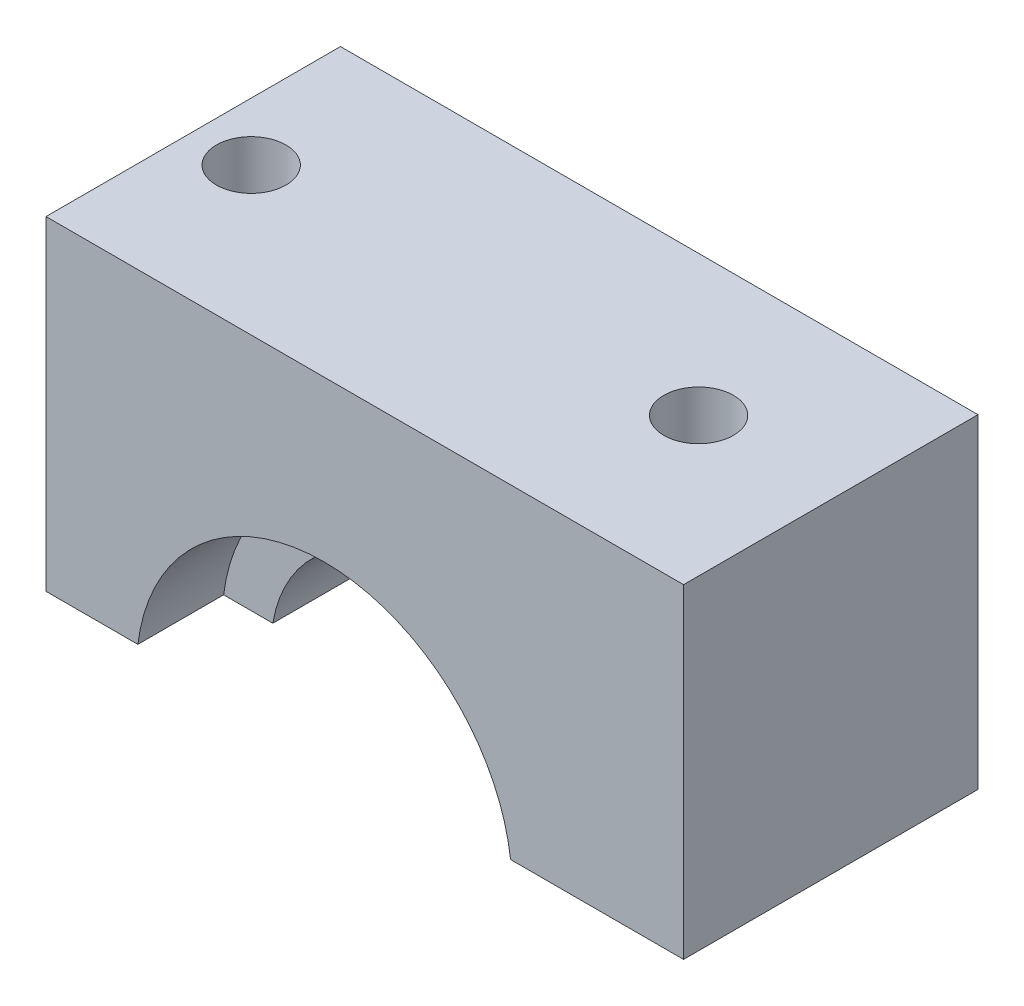
from build123d import *

# Parameters (mm, degrees)
SKETCH1_W           = 24
SKETCH1_H           = 12.7
BOSS_EXTRUDE1_DEPTH = 15
SKETCH2_R           = 6
CUT_EXTRUDE1_DEPTH  = 15
SKETCH3_R           = 8.1
CUT_EXTRUDE2_DEPTH  = 3.7
CUT_EXTRUDE3_START  = -3.4
SKETCH5_R           = 8.1
CUT_EXTRUDE3_DEPTH  = 3.4
SKETCH6_W           = 24
SKETCH6_H           = 12.7
CUT_EXTRUDE4_DEPTH  = 1
SKETCH7_R           = 1.5
CUT_EXTRUDE5_DEPTH  = 22
SKETCH8_W           = 12.7
SKETCH8_H           = 14
BOSS_EXTRUDE2_DEPTH = 3.5


with BuildPart() as part:
    # Sketch1 → Boss-Extrude1 (new body)
    with BuildSketch(Plane(origin=(0, 0, 0), x_dir=(1, 0, 0), z_dir=(0, 1, 0))):
        with Locations((-12, 6.35)):
            Rectangle(SKETCH1_W, SKETCH1_H)
    extrude(amount=BOSS_EXTRUDE1_DEPTH)

    # Sketch2 → Cut-Extrude1 (cut)
    with BuildSketch(Plane.XY):
        with Locations((-12, 0)):
            Circle(SKETCH2_R)
    extrude(amount=-CUT_EXTRUDE1_DEPTH, mode=Mode.SUBTRACT)

    # Sketch3 → Cut-Extrude2 (cut)
    with BuildSketch(Plane.XY):
        with Locations((-12, 0)):
            Circle(SKETCH3_R)
    extrude(amount=-CUT_EXTRUDE2_DEPTH, mode=Mode.SUBTRACT)

    # Sketch5 → Cut-Extrude3 (cut)
    with BuildSketch(Plane(origin=(0, 0, -12.7), x_dir=(-1, 0, 0), z_dir=(0, 0, -1)).offset(CUT_EXTRUDE3_START)):
        with Locations((12, 0)):
            Circle(SKETCH5_R)
    extrude(amount=CUT_EXTRUDE3_DEPTH, mode=Mode.SUBTRACT)

    # Sketch6 → Cut-Extrude4 (cut)
    with BuildSketch(Plane.XZ):
        with Locations((-12, -6.35)):
            Rectangle(SKETCH6_W, SKETCH6_H)
    extrude(amount=-CUT_EXTRUDE4_DEPTH, mode=Mode.SUBTRACT)

    # Sketch7 → Cut-Extrude5 (cut)
    with BuildSketch(Plane.XZ.offset(-1)):
        with Locations(Location((-21.5, -6.35, 0), (0, 0, 270))):
            Circle(SKETCH7_R)
        with Locations(Location((-2.5, -6.65, 0), (0, 0, 270))):
            Circle(SKETCH7_R)
    extrude(amount=-CUT_EXTRUDE5_DEPTH, mode=Mode.SUBTRACT)

    # Sketch8 → Boss-Extrude2 (add)
    with BuildSketch(Plane(origin=(0, 0, 0), x_dir=(0, 0, -1), z_dir=(1, 0, 0))):
        with Locations((6.35, 8)):
            Rectangle(SKETCH8_W, SKETCH8_H)
    extrude(amount=BOSS_EXTRUDE2_DEPTH)


solid = part.part
